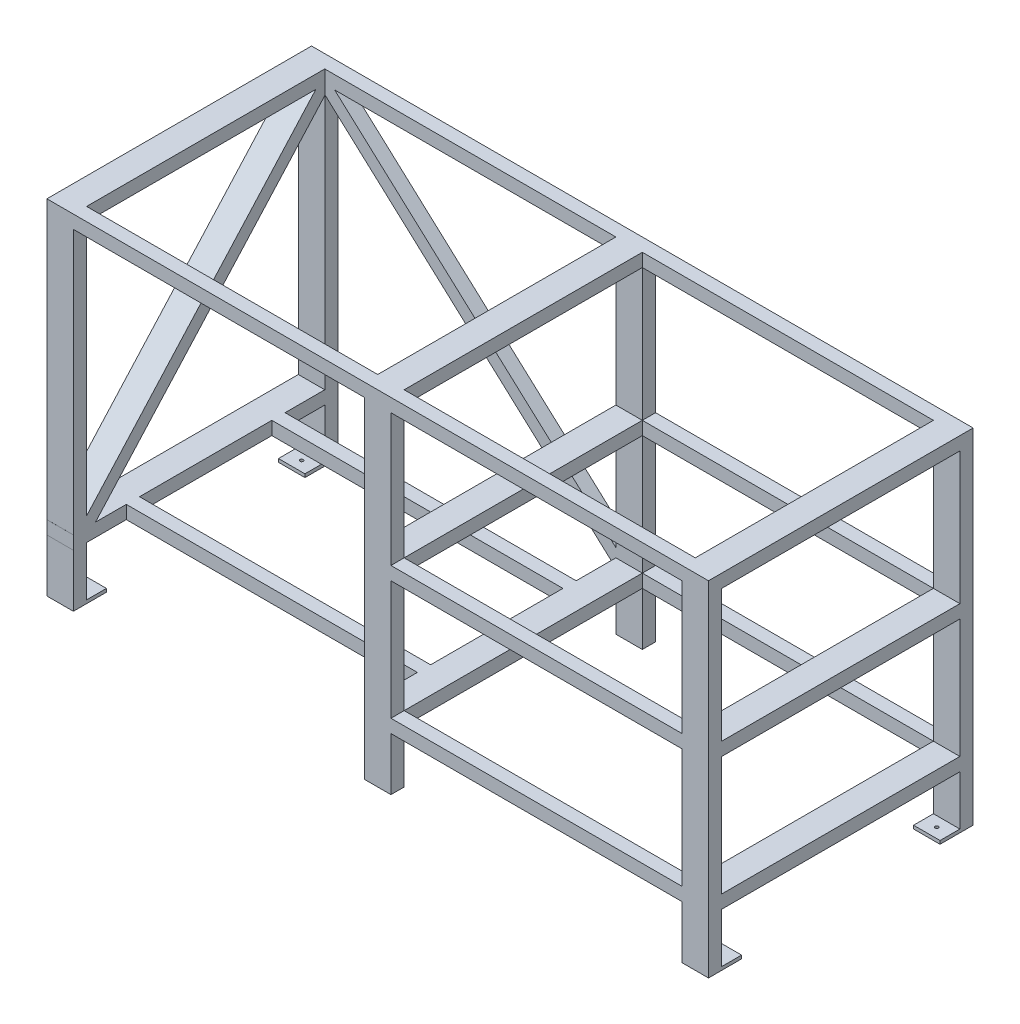
from build123d import *

# Parameters (mm, degrees)
SKETCH1_W                      = 80
SKETCH1_H                      = 40
BOSS_EXTRUDE1_DEPTH            = 1000
BOSS_EXTRUDE1_2_DEPTH          = 1000
BOSS_EXTRUDE1_3_DEPTH          = 1000
BOSS_EXTRUDE1_4_DEPTH          = 1000
BOSS_EXTRUDE1_5_DEPTH          = 1000
BOSS_EXTRUDE1_6_DEPTH          = 1000
SKETCH3_W                      = 880
SKETCH3_H                      = 720
SKETCH3_H_2                    = 400
BOSS_EXTRUDE2_DEPTH            = 40
SKETCH4_W                      = 1040
SKETCH4_H                      = 800
SKETCH4_W_2                    = 880
SKETCH4_H_2                    = 720
BOSS_EXTRUDE4_DEPTH            = 40
SKETCH6_W                      = 2000
SKETCH6_H                      = 800
SKETCH6_W_2                    = 880
SKETCH6_H_2                    = 720
BOSS_EXTRUDE5_DEPTH            = 40
SKETCH7_W                      = 80
SKETCH7_H                      = 40
SKETCH8_W                      = 40
SKETCH8_H                      = 40
SKETCH9_W                      = 80
SKETCH9_H                      = 60
BOSS_EXTRUDE6_DEPTH            = 10
F_10_0_10_DIAMETER_HOLE1_D     = 10
F_10_0_10_DIAMETER_HOLE1_DEPTH = 10
MIRROR5_COPY_1_SKETCH_W        = 80
MIRROR5_COPY_1_SKETCH_H        = 60
MIRROR5_COPY_1_DEPTH           = 10
MIRROR5_COPY_2_D               = 10
MIRROR5_COPY_2_DEPTH           = 10


with BuildPart() as part:
    # Sketch1 → Boss-Extrude1 (new body)
    with BuildSketch(Plane(origin=(0, 0, 0), x_dir=(1, 0, 0), z_dir=(0, 1, 0))):
        with Locations((-960, -380)):
            Rectangle(SKETCH1_W, SKETCH1_H)
    extrude(amount=BOSS_EXTRUDE1_DEPTH)



with BuildPart() as body_2:
    # Sketch1 → Boss-Extrude1 2 (new body)
    with BuildSketch(Plane(origin=(0, 0, 0), x_dir=(1, 0, 0), z_dir=(0, 1, 0))):
        with Locations((0, -380)):
            Rectangle(SKETCH1_W, SKETCH1_H)
    extrude(amount=BOSS_EXTRUDE1_2_DEPTH)


with BuildPart() as body_3:
    # Sketch1 → Boss-Extrude1 3 (new body)
    with BuildSketch(Plane(origin=(0, 0, 0), x_dir=(1, 0, 0), z_dir=(0, 1, 0))):
        with Locations((0, 380)):
            Rectangle(SKETCH1_W, SKETCH1_H)
    extrude(amount=BOSS_EXTRUDE1_3_DEPTH)


with BuildPart() as body_4:
    # Sketch1 → Boss-Extrude1 4 (new body)
    with BuildSketch(Plane(origin=(0, 0, 0), x_dir=(1, 0, 0), z_dir=(0, 1, 0))):
        with Locations((-960, 380)):
            Rectangle(SKETCH1_W, SKETCH1_H)
    extrude(amount=BOSS_EXTRUDE1_4_DEPTH)


with BuildPart() as body_5:
    # Sketch1 → Boss-Extrude1 5 (new body)
    with BuildSketch(Plane(origin=(0, 0, 0), x_dir=(1, 0, 0), z_dir=(0, 1, 0))):
        with Locations((960, -380)):
            Rectangle(SKETCH1_W, SKETCH1_H)
    extrude(amount=BOSS_EXTRUDE1_5_DEPTH)


with BuildPart() as body_6:
    # Sketch1 → Boss-Extrude1 6 (new body)
    with BuildSketch(Plane(origin=(0, 0, 0), x_dir=(1, 0, 0), z_dir=(0, 1, 0))):
        with Locations((960, 380)):
            Rectangle(SKETCH1_W, SKETCH1_H)
    extrude(amount=BOSS_EXTRUDE1_6_DEPTH)


with BuildPart() as part_1:
    add(part.part)

    add(body_2.part)  # Boss-Extrude2 merges body 2

    add(body_3.part)  # Boss-Extrude2 merges body 3

    add(body_4.part)  # Boss-Extrude2 merges body 4

    add(body_5.part)  # Boss-Extrude2 merges body 5

    add(body_6.part)  # Boss-Extrude2 merges body 6
    # Sketch3 → Boss-Extrude2 (add)
    with BuildSketch(Plane(origin=(0, 200, 0), x_dir=(-1, 0, 0), z_dir=(0, -1, 0))):
        Polygon((920, -240), (40, -240), (40, -400), (-1000, -400), (-1000, 400), (40, 400), (40, 240), (920, 240), (920, 400), (1000, 400), (1000, -400.075117412), (920, -400.075117412), align=None)
        with Locations((-480, 0)):
            Rectangle(SKETCH3_W, SKETCH3_H, mode=Mode.SUBTRACT)
        with Locations((480, 0)):
            Rectangle(SKETCH3_W, SKETCH3_H_2, mode=Mode.SUBTRACT)
    extrude(amount=BOSS_EXTRUDE2_DEPTH)

    # Sketch4 → Boss-Extrude4 (add)
    with BuildSketch(Plane(origin=(0, 600, 0), x_dir=(-1, 0, 0), z_dir=(0, -1, 0))):
        with Locations((-480, 0)):
            Rectangle(SKETCH4_W, SKETCH4_H)
        with Locations((-480, 0)):
            Rectangle(SKETCH4_W_2, SKETCH4_H_2, mode=Mode.SUBTRACT)
    extrude(amount=BOSS_EXTRUDE4_DEPTH)

    # Sketch6 → Boss-Extrude5 (add)
    with BuildSketch(Plane(origin=(0, 1000, 0), x_dir=(1, 0, 0), z_dir=(0, 1, 0))):
        Rectangle(SKETCH6_W, SKETCH6_H)
        with Locations((-480, 0)):
            Rectangle(SKETCH6_W_2, SKETCH6_H_2, mode=Mode.SUBTRACT)
        with Locations((480, 0)):
            Rectangle(SKETCH6_W_2, SKETCH6_H_2, mode=Mode.SUBTRACT)
    extrude(amount=BOSS_EXTRUDE5_DEPTH)

    # Sweep1: sweep along a curve in space
    with BuildLine() as sweep1_path:
        Line((-960, 200, 360), (-960, 1000, -360))
    # Sketch7 → Sweep1 (sweep)
    with BuildSketch(Plane(origin=(-960, 200, 360), x_dir=(1, 0, 0), z_dir=(0, 0.7432941462471683, -0.6689647316224475))):
        Rectangle(SKETCH7_W, SKETCH7_H)
    sweep(path=sweep1_path.line)

    # Sweep2: sweep along a curve in space
    with BuildLine() as sweep2_path:
        Line((-40, 200, -380), (-920, 1000, -380))
    # Sketch8 → Sweep2 (sweep)
    with BuildSketch(Plane(origin=(-40, 200, -380), x_dir=(0, 0, 1), z_dir=(-0.7399400733959437, 0.6726727939963126, -3.6407320166765e-15))):
        Rectangle(SKETCH8_W, SKETCH8_H)
    sweep(path=sweep2_path.line)

    # Sketch9 → Boss-Extrude6 (add)
    with BuildSketch(Plane.XZ):
        with Locations((960, -330)):
            Rectangle(SKETCH9_W, SKETCH9_H)
    boss_extrude6 = extrude(amount=-BOSS_EXTRUDE6_DEPTH)

    # Ø10.0 (10) Diameter Hole1
    with Locations(Plane(origin=(0, 10, 0), x_dir=(1, 0, 0), z_dir=(0, 1, 0))):
        with Locations((960, 330)):
            f_10_0_10_diameter_hole1 = Hole(F_10_0_10_DIAMETER_HOLE1_D / 2, depth=F_10_0_10_DIAMETER_HOLE1_DEPTH)

    # Mirror4: Boss-Extrude6, Ø10.0 (10) Diameter Hole1 across plane
    add(boss_extrude6.mirror(Plane.XY))
    add(f_10_0_10_diameter_hole1.mirror(Plane.XY), mode=Mode.SUBTRACT)

    # Mirror5: Boss-Extrude6, Ø10.0 (10) Diameter Hole1 across plane
    add(boss_extrude6.mirror(Plane(origin=(0, 0, 0), x_dir=(0, 0, 1), z_dir=(1, 0, 0))))
    add(f_10_0_10_diameter_hole1.mirror(Plane(origin=(0, 0, 0), x_dir=(0, 0, 1), z_dir=(1, 0, 0))), mode=Mode.SUBTRACT)

    # Mirror5 copy 1 sketch → Mirror5 copy 1 (add)
    with BuildSketch(Plane(origin=(0, 0, 0), x_dir=(-1, 0, 0), z_dir=(0, -1, 0))):
        with Locations((960, -330)):
            Rectangle(MIRROR5_COPY_1_SKETCH_W, MIRROR5_COPY_1_SKETCH_H)
    extrude(amount=-MIRROR5_COPY_1_DEPTH)

    # Mirror5 copy 2
    with Locations(Plane(origin=(0, 10, 0), x_dir=(-1, 0, 0), z_dir=(0, 1, 0))):
        with Locations((960, 330)):
            Hole(MIRROR5_COPY_2_D / 2, depth=MIRROR5_COPY_2_DEPTH)


solid = part_1.part
